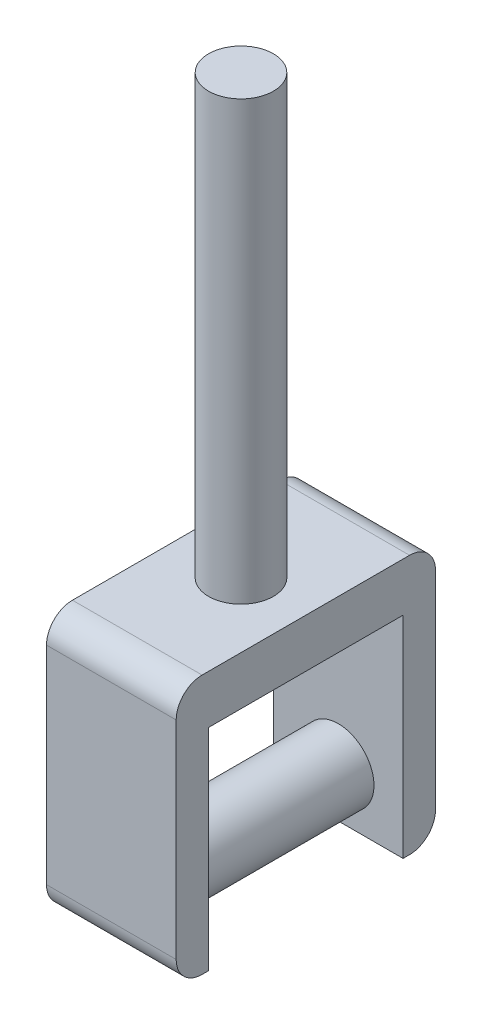
from build123d import *

# Parameters (mm, degrees)
SKETCH_1_R           = 10
EXTRUDE_1_DEPTH      = 150
EXTRUDE_2_DEPTH      = 20
EXTRUDE_2_DEPTH_BACK = 20
EXTRUDE_3_REACH      = 168.733
SKETCH_3_R           = 11.024808504


with BuildPart() as part:
    # 草图1 → 凸台-拉伸1 (new body)
    with BuildSketch(Plane(origin=(0, 0, 0), x_dir=(1, 0, 0), z_dir=(0, 1, 0))):
        Circle(SKETCH_1_R)
    extrude(amount=EXTRUDE_1_DEPTH)

    # 草图2 → 凸台-拉伸2 (add, two sides: drawn at the far end of the back side and taken through both)
    with BuildSketch(Plane(origin=(0, 0, 0), x_dir=(0, 0, -1), z_dir=(1, 0, 0)).offset(-EXTRUDE_2_DEPTH_BACK)):
        with BuildLine():
            Line((-30, -65), (-30, 0))
            Line((-30, 0), (30, 0))
            Line((30, 0), (30, -65))
            Line((30, -65), (32, -65))
            ThreePointArc((32, -65), (37.656854249, -62.656854249), (40, -57))
            Line((40, -57), (40, 7))
            ThreePointArc((40, 7), (37.656854249, 12.656854249), (32, 15))
            Line((32, 15), (-32, 15))
            ThreePointArc((-32, 15), (-37.656854249, 12.656854249), (-40, 7))
            Line((-40, 7), (-40, -57))
            ThreePointArc((-40, -57), (-37.656854249, -62.656854249), (-32, -65))
            Line((-32, -65), (-30, -65))
        make_face()
    extrude(amount=EXTRUDE_2_DEPTH + EXTRUDE_2_DEPTH_BACK)

    # 草图3 → 凸台-拉伸3 (add, up to next)
    with BuildSketch(Plane.XY.offset(-30), mode=Mode.PRIVATE) as extrude_3_sk1:
        with Locations((0, -50)):
            Circle(SKETCH_3_R)
    extrude_3_tool1 = extrude(extrude_3_sk1.sketch, amount=EXTRUDE_3_REACH, mode=Mode.PRIVATE) - part.part
    add(extrude_3_tool1.solids().sort_by_distance((0, -50, -30))[0])


solid = part.part
